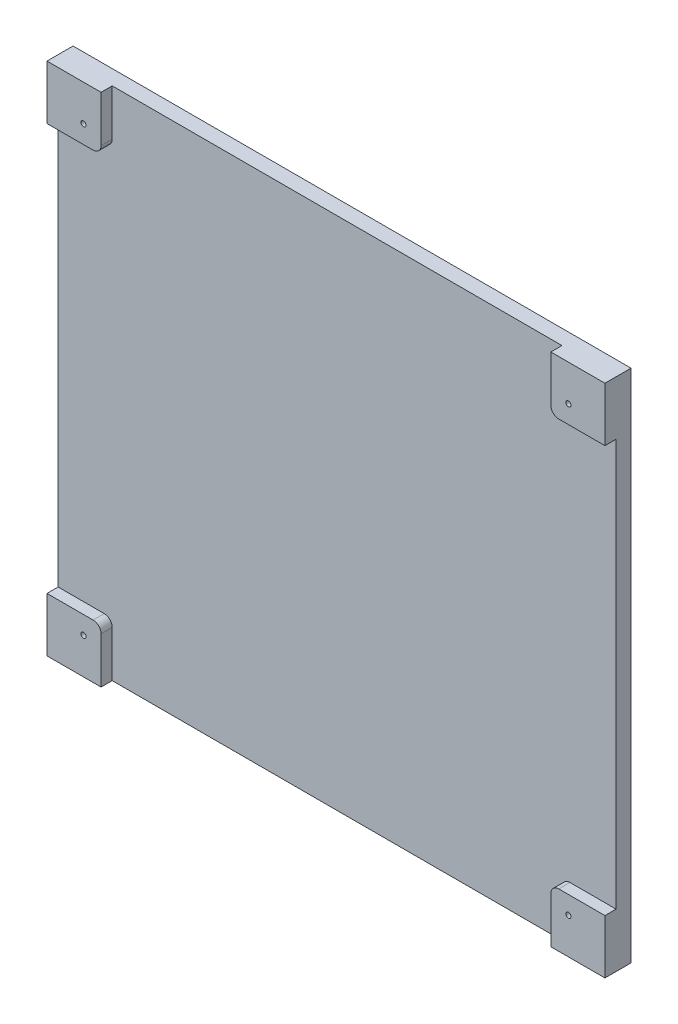
from build123d import *

# Parameters (mm, degrees)
SKETCH1_W           = 161.892
SKETCH1_H           = 175.354
BOSS_EXTRUDE1_DEPTH = 5
SKETCH2_W           = 17
SKETCH2_H           = 17
BOSS_EXTRUDE2_DEPTH = 3.5
SKETCH3_R           = 0.8
CUT_EXTRUDE1_DEPTH  = 120.63177356
FILLET1_R           = 2.5
CHAMFER1_SIZE       = 0.3


with BuildPart() as part:
    # Sketch1 → Boss-Extrude1 (new body)
    with BuildSketch(Plane(origin=(0, 0, 0), x_dir=(0, 1, 0), z_dir=(0, 0, 1))):
        Rectangle(SKETCH1_W, SKETCH1_H)
    extrude(amount=BOSS_EXTRUDE1_DEPTH)

    # Sketch2 → Boss-Extrude2 (add)
    with BuildSketch(Plane.XY.offset(5)):
        with Locations((79.177, 72.446)):
            Rectangle(SKETCH2_W, SKETCH2_H)
        with Locations((79.177, -72.446)):
            Rectangle(SKETCH2_W, SKETCH2_H)
        with Locations((-79.177, -72.446)):
            Rectangle(SKETCH2_W, SKETCH2_H)
        with Locations((-79.177, 72.446)):
            Rectangle(SKETCH2_W, SKETCH2_H)
    extrude(amount=BOSS_EXTRUDE2_DEPTH)

    # Sketch3 → Cut-Extrude1 (cut, through all)
    with BuildSketch(Plane.XY.offset(8.5)):
        with Locations((-76.2, 69.596)):
            Circle(SKETCH3_R)
        with Locations((76.2, 69.596)):
            Circle(SKETCH3_R)
        with Locations((76.2, -69.596)):
            Circle(SKETCH3_R)
        with Locations((-76.2, -69.596)):
            Circle(SKETCH3_R)
    extrude(amount=-CUT_EXTRUDE1_DEPTH, mode=Mode.SUBTRACT)

    # Fillet1
    fillet1_edges = [part.edges().sort_by_distance(p)[0] for p in [
        (-70.677, 63.946, 6.75),
        (70.677, 63.946, 6.75),
        (70.677, -63.946, 6.75),
        (-70.677, -63.946, 6.75),
    ]]
    fillet(fillet1_edges, radius=FILLET1_R)

    # Chamfer1
    chamfer1_edges = [part.edges().sort_by_distance(p)[0] for p in [
        (87.677, 0, 0),
        (0, -80.946, 0),
        (-87.677, 0, 0),
        (0, 80.946, 0),
        (-77, -69.596, 0),
        (75.4, -69.596, 0),
        (75.4, 69.596, 0),
        (-77, 69.596, 0),
    ]]
    chamfer(chamfer1_edges, length=CHAMFER1_SIZE)


solid = part.part
